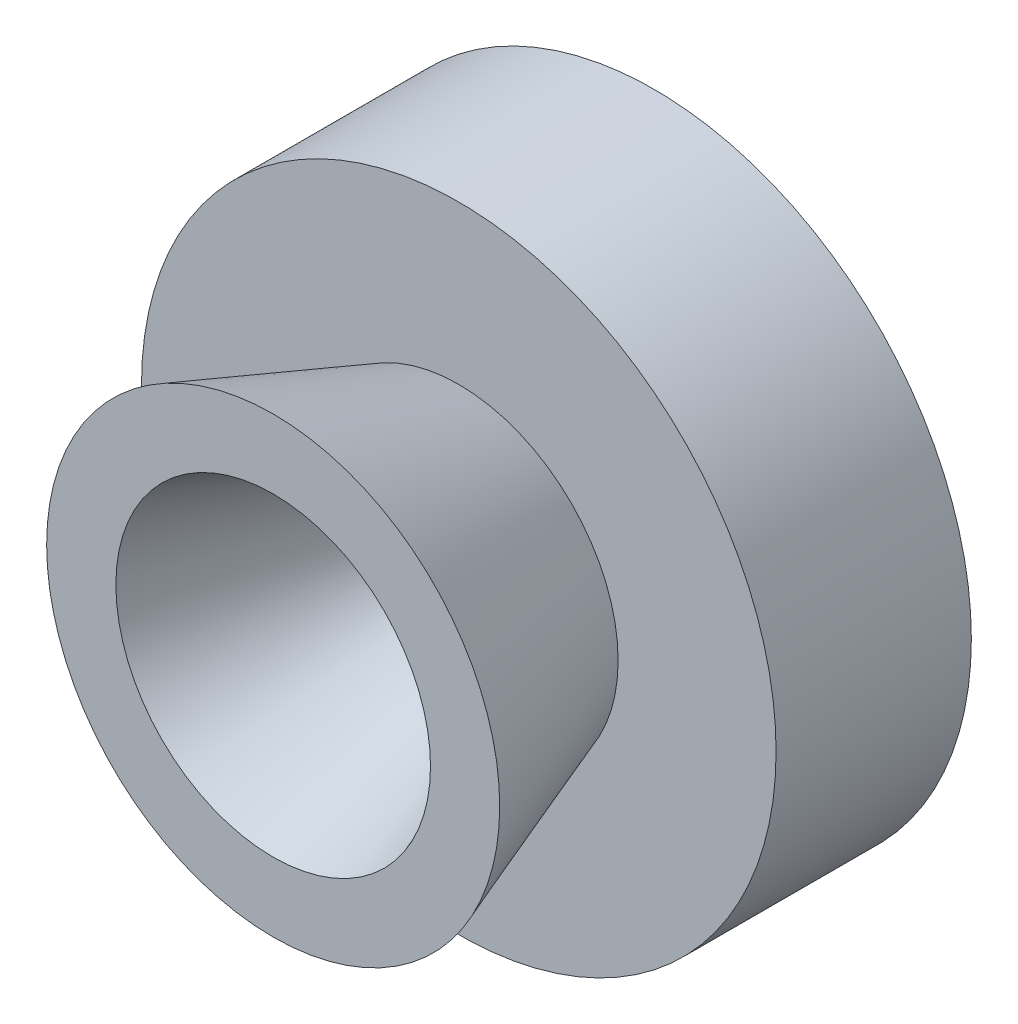
from build123d import *

# Parameters (mm, degrees)
ESBO_O1_R                = 9.75
RESSALTO_EXTRUS_O1_DEPTH = 6
CASCA9_T                 = -2
ESBO_O3_R                = 2.045070657
CORTE_EXTRUS_O2_DEPTH    = 17.860255581
ESBO_O4_R                = 5.75
CORTE_EXTRUS_O3_DEPTH    = 5


with BuildPart() as part:
    # Esboço1 → Ressalto-extrusão1 (new body)
    with BuildSketch(Plane.XY):
        Circle(ESBO_O1_R)
    extrude(amount=-RESSALTO_EXTRUS_O1_DEPTH)

    # Esboço2 → Revolução1 (revolve)
    with BuildSketch(Plane(origin=(0, 0, 0), x_dir=(1, 0, 0), z_dir=(0, 1, 0)), mode=Mode.PRIVATE) as revolu_o1_sk:
        Polygon((0, 0), (-4.896169564, 0), (-6.960749361, -5.702742821), (0, -5.702742821), align=None)
    revolve(revolu_o1_sk.sketch.rotate(Axis((0, 0, 5.702742821), (0, 0, -1)), 180), axis=Axis((0, 0, 5.702742821), (0, 0, -1)))

    # Casca9
    casca9_openings = [part.faces().sort_by_distance(p)[0] for p in [
        (0, 0, 5.702742821),
    ]]
    offset(amount=CASCA9_T, openings=casca9_openings, kind=Kind.INTERSECTION)

    # Esboço3 → Corte-extrusão2 (cut, through all)
    with BuildSketch(Plane.XY.offset(-4)):
        Circle(ESBO_O3_R)
    extrude(amount=-CORTE_EXTRUS_O2_DEPTH, mode=Mode.SUBTRACT)

    # Esboço4 → Corte-extrusão3 (cut)
    with BuildSketch(Plane(origin=(0, 0, -6), x_dir=(-1, 0, 0), z_dir=(0, 0, -1))):
        Circle(ESBO_O4_R)
    extrude(amount=-CORTE_EXTRUS_O3_DEPTH, mode=Mode.SUBTRACT)


solid = part.part
